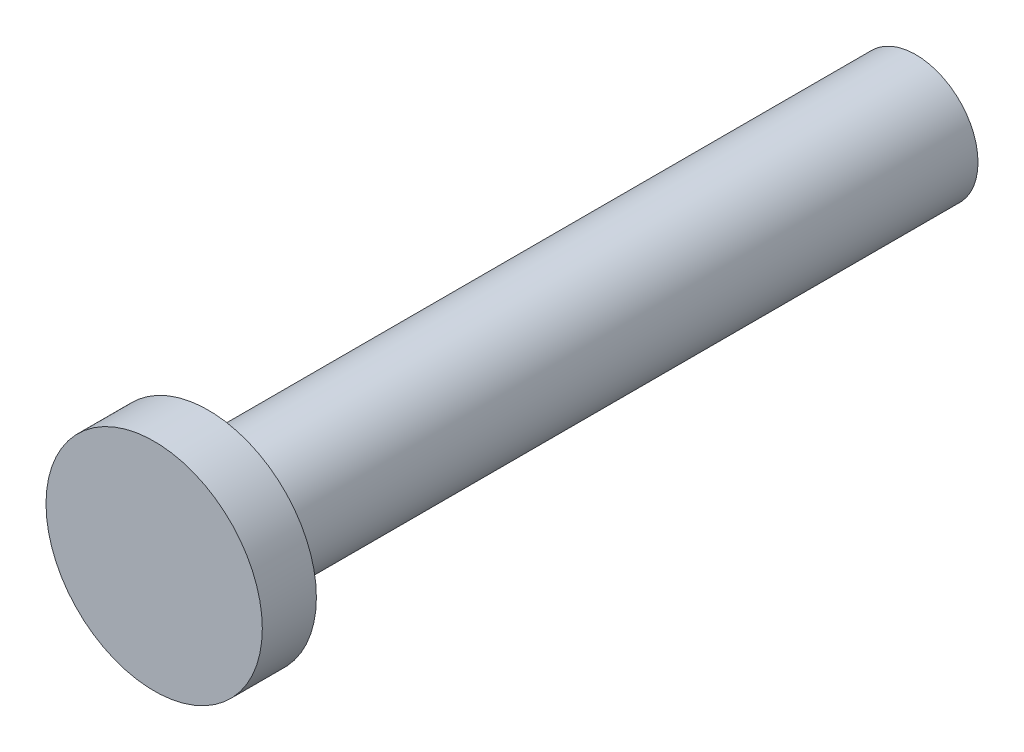
from build123d import *

# Parameters (mm, degrees)
EXTRUDE_1_DEPTH      = 10.422066
EXTRUDE_1_DEPTH_BACK = 55
SKETCH_1_R           = 5.75
SKETCH_2_R           = 10
EXTRUDE_2_DEPTH      = 5


with BuildPart() as part:
    # 草图1 → 凸台-拉伸1 (new, two sides: drawn at the far end of the back side and taken through both)
    with BuildSketch(Plane.XY.offset(-EXTRUDE_1_DEPTH_BACK)):
        with Locations((-112.4218656, 18.5)):
            Circle(SKETCH_1_R)
    extrude(amount=EXTRUDE_1_DEPTH + EXTRUDE_1_DEPTH_BACK)


with BuildPart() as extrude_2_tool:
    # 草图2 → 凸台-拉伸2 (new body)
    with BuildSketch(Plane.XY.offset(10.422066321)):
        with Locations((-112.4218656, 18.5)):
            Circle(SKETCH_2_R)
    extrude(amount=EXTRUDE_2_DEPTH)


with BuildPart() as part_1:
    add(part.part)


with BuildPart() as part_2:
    # 凸台-拉伸2: joined with extrude_2_tool
    add(part_1.part.fuse(extrude_2_tool.part, tol=0.00001))


solid = part_2.part
